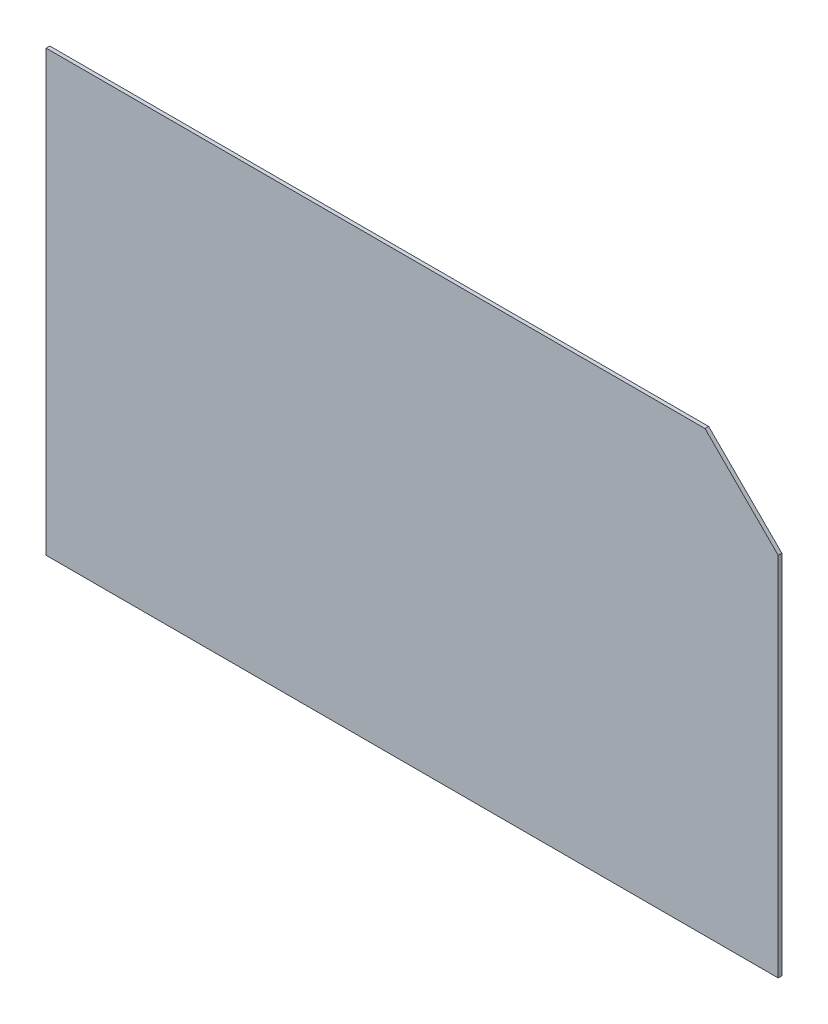
from build123d import *

# Parameters (mm, degrees)
SKETCH2_W           = 5000
SKETCH2_H           = 3000
BOSS_EXTRUDE1_DEPTH = 25
CUT_EXTRUDE1_DEPTH  = 932


with BuildPart() as part:
    # Sketch2 → Boss-Extrude1 (new body)
    with BuildSketch(Plane.XY):
        with Locations((394.103489771, 1147.412755716)):
            Rectangle(SKETCH2_W, SKETCH2_H)
    extrude(amount=-BOSS_EXTRUDE1_DEPTH)

    # Sketch3 → Cut-Extrude1 (cut)
    with BuildSketch(Plane.XY):
        Polygon((2894.103489771, 2147.412755716), (2894.103489771, 2647.412755716), (2394.103489771, 2647.412755716), align=None)
    extrude(amount=-CUT_EXTRUDE1_DEPTH, mode=Mode.SUBTRACT)


solid = part.part
